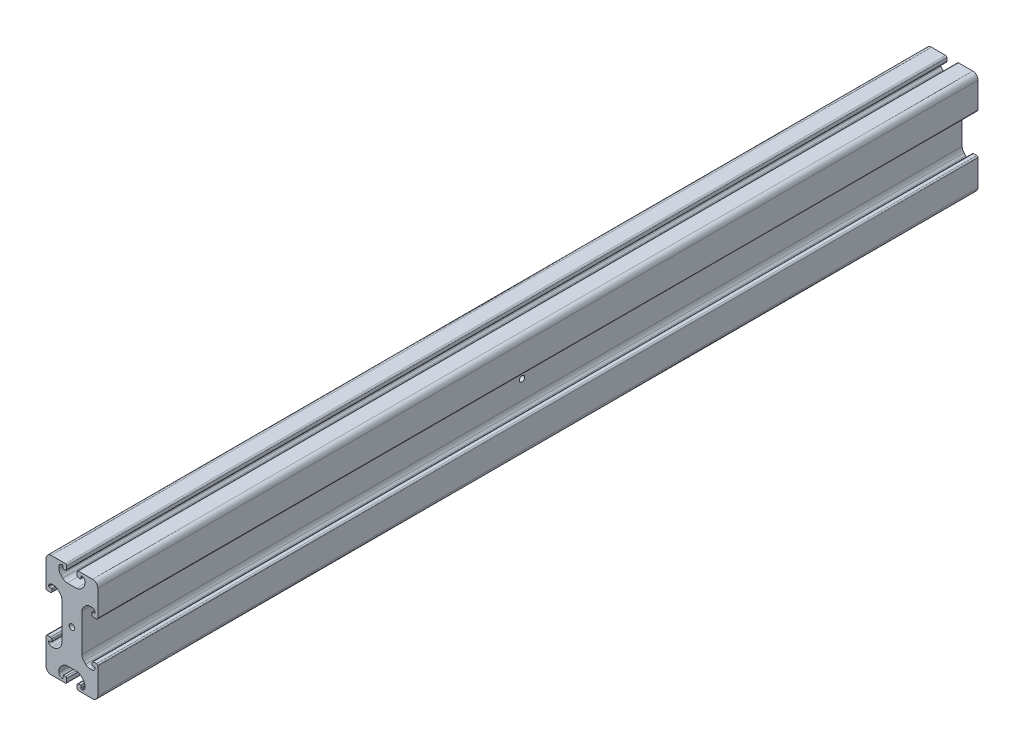
from build123d import *

# Parameters (mm, degrees)
EXTRUDE_3_DEPTH    = 680
HOLE_WIZARD_M5_3_D = 4.2
HOLE_WIZARD_M5_4_D = 4.2


with BuildPart() as part:
    # Model → 凸台-拉伸3 (new body)
    with BuildSketch(Plane.XY):
        with BuildLine():
            Line((3.999472658, -39.000181636), (3.999472658, -36.500124402))
            add(Edge.make_bspline(
                [(3.999472658, -36.500124402), (3.999472658, -36.196236873), (4.293414368, -35.706130333), (4.745630292, -35.500196885), (4.999400134, -35.500196885)],
                knots=[0, 0, 0, 0, 0.565195279, 1, 1, 1, 1], degree=3))
            Line((4.999400134, -35.500196885), (6.499529844, -35.500196885))
            add(Edge.make_bspline(
                [(6.499529844, -35.500196885), (6.63037713, -35.500196885), (6.879742835, -35.617724815), (6.999493611, -35.841806727), (6.999493611, -36.000160635)],
                knots=[0, 0, 0, 0, 0.482405948, 1, 1, 1, 1], degree=3))
            Line((6.999493611, -36.000160635), (6.999493611, -37.550119818))
            add(Edge.make_bspline(
                [(6.999493611, -37.550119818), (6.999493611, -37.68387873), (7.126407697, -37.905146806), (7.329892845, -38.000254077), (7.449389479, -38.000254077)],
                knots=[0, 0, 0, 0, 0.549542039, 1, 1, 1, 1], degree=3))
            Line((7.449389479, -38.000254077), (7.499457385, -38.000254077))
            add(Edge.make_bspline(
                [(7.499457385, -38.000254077), (8.196685376, -38.000254077), (9.439597977, -37.396472021), (9.999514571, -36.259346854), (9.999514571, -35.500196937)],
                knots=[0, 0, 0, 0, 0.502793736, 1, 1, 1, 1], degree=3))
            Line((9.999514571, -35.500196937), (9.999514571, -34.192709266))
            add(Edge.make_bspline(
                [(9.999514571, -34.192709266), (9.999514571, -33.503441971), (9.70814132, -32.22115212), (9.008369725, -31.13073904), (8.534909328, -30.657200372)],
                knots=[0, 0, 0, 0, 0.510203542, 1, 1, 1, 1], degree=3))
            Line((8.534909328, -30.657200372), (7.092715241, -29.214767864))
            add(Edge.make_bspline(
                [(7.092715241, -29.214767864), (6.626557723, -28.748533282), (5.520442081, -28.038933473), (4.256932424, -27.750162542), (3.556967756, -27.750162542)],
                knots=[0, 0, 0, 0, 0.489373028, 1, 1, 1, 1], degree=3))
            Line((3.556967756, -27.750162542), (-3.558157913, -27.750162542))
            add(Edge.make_bspline(
                [(-7.093905398, -29.214767864), (-6.62774788, -28.748533282), (-5.521632239, -28.038933473), (-4.258122582, -27.750162542), (-3.558157913, -27.750162542)],
                knots=[0, 0, 0, 0, 0.489373028, 1, 1, 1, 1], degree=3))
            Line((-7.093905398, -29.214767864), (-8.536099486, -30.657200372))
            add(Edge.make_bspline(
                [(-10.000704728, -34.192709266), (-10.000704728, -33.503441971), (-9.709331478, -32.22115212), (-9.009559883, -31.13073904), (-8.536099486, -30.657200372)],
                knots=[0, 0, 0, 0, 0.510203542, 1, 1, 1, 1], degree=3))
            Line((-10.000704728, -34.192709266), (-10.000704728, -35.500196937))
            add(Edge.make_bspline(
                [(-7.500647542, -38.000254077), (-8.197875534, -38.000254077), (-9.440788134, -37.396472021), (-10.000704728, -36.259346854), (-10.000704728, -35.500196937)],
                knots=[0, 0, 0, 0, 0.502793736, 1, 1, 1, 1], degree=3))
            Line((-7.500647542, -38.000254077), (-7.450579636, -38.000254077))
            add(Edge.make_bspline(
                [(-7.000683769, -37.550119818), (-7.000683769, -37.68387873), (-7.127597855, -37.905146806), (-7.331083002, -38.000254077), (-7.450579636, -38.000254077)],
                knots=[0, 0, 0, 0, 0.549542039, 1, 1, 1, 1], degree=3))
            Line((-7.000683769, -37.550119818), (-7.000683769, -36.000160635))
            add(Edge.make_bspline(
                [(-6.500720002, -35.500196885), (-6.631567288, -35.500196885), (-6.880932992, -35.617724815), (-7.000683769, -35.841806727), (-7.000683769, -36.000160635)],
                knots=[0, 0, 0, 0, 0.482405948, 1, 1, 1, 1], degree=3))
            Line((-6.500720002, -35.500196885), (-5.000590292, -35.500196885))
            add(Edge.make_bspline(
                [(-4.000662815, -36.500124402), (-4.000662815, -36.196236873), (-4.294604526, -35.706130333), (-4.74682045, -35.500196885), (-5.000590292, -35.500196885)],
                knots=[0, 0, 0, 0, 0.565195279, 1, 1, 1, 1], degree=3))
            Line((-4.000662815, -36.500124402), (-4.000662815, -39.000181636))
            add(Edge.make_bspline(
                [(-5.000590371, -40.000229591), (-4.784189842, -40.000231912), (-4.285443251, -39.782455558), (-4.000662815, -39.355924286), (-4.000662815, -39.000181636)],
                knots=[0, 0, 0, 0, 0.421033767, 1, 1, 1, 1], degree=3))
            Line((-5.000590371, -40.000229591), (-16.000746773, -40.000347536))
            add(Edge.make_bspline(
                [(-16.000746773, -40.000347536), (-17.349688489, -40.000333073), (-19.09346858, -38.939702082), (-20.000695162, -36.942666397), (-20.000695162, -36.000042867)],
                knots=[0, 0, 0, 0, 0.5505478, 1, 1, 1, 1], degree=3))
            Line((-20.000695162, -36.000042867), (-20.000598045, -15.942432522))
            add(Edge.make_bspline(
                [(-20.000598045, -15.942432522), (-20.000598045, -15.605249138), (-19.735530395, -15.169209703), (-19.236197926, -14.942504908), (-19.000432174, -14.942504908)],
                knots=[0, 0, 0, 0, 0.550414522, 1, 1, 1, 1], degree=3))
            Line((-19.000432174, -14.942504908), (-16.500613361, -14.942504908))
            add(Edge.make_bspline(
                [(-16.500613361, -14.942504908), (-16.164706379, -14.942504908), (-15.72801004, -15.206023191), (-15.500447428, -15.705242106), (-15.500447428, -15.942432383)],
                knots=[0, 0, 0, 0, 0.548463708, 1, 1, 1, 1], degree=3))
            Line((-15.500447428, -15.942432383), (-15.500447428, -17.4425621))
            add(Edge.make_bspline(
                [(-15.500447428, -17.4425621), (-15.500447428, -17.608710279), (-15.630522706, -17.827868173), (-15.880200984, -17.942525865), (-16.000649583, -17.942525865)],
                knots=[0, 0, 0, 0, 0.543007867, 1, 1, 1, 1], degree=3))
            Line((-16.000649583, -17.942525865), (-17.550608771, -17.942525865))
            add(Edge.make_bspline(
                [(-17.550608771, -17.942525865), (-17.717479695, -17.942525865), (-17.906336203, -18.07710785), (-18.000504622, -18.301237903), (-18.000504622, -18.39242171)],
                knots=[0, 0, 0, 0, 0.601271686, 1, 1, 1, 1], degree=3))
            Line((-18.000504622, -18.39242171), (-18.000504622, -18.442489684))
            add(Edge.make_bspline(
                [(-18.000504622, -18.442489684), (-18.000504622, -19.274352714), (-17.350615539, -20.370387522), (-16.102445977, -20.942546832), (-15.500447386, -20.942546832)],
                knots=[0, 0, 0, 0, 0.54350612, 1, 1, 1, 1], degree=3))
            Line((-15.500447386, -20.942546832), (-14.192959898, -20.942546832))
            add(Edge.make_bspline(
                [(-14.192959898, -20.942546832), (-13.514309542, -20.942546832), (-12.246415164, -20.669775925), (-11.141172405, -19.961663094), (-10.657450902, -19.477941591)],
                knots=[0, 0, 0, 0, 0.495306505, 1, 1, 1, 1], degree=3))
            Line((-10.657450902, -19.477941591), (-9.21501842, -18.03550911))
            add(Edge.make_bspline(
                [(-9.21501842, -18.03550911), (-8.750710178, -17.571200868), (-8.056726555, -16.479176153), (-7.750651503, -15.196538932), (-7.750651503, -14.499999999)],
                knots=[0, 0, 0, 0, 0.481772339, 1, 1, 1, 1], degree=3))
            Line((-7.750651503, -14.499999999), (-7.750340561, 14.499999999))
            add(Edge.make_bspline(
                [(-9.214631662, 18.035540511), (-8.750333377, 17.571222312), (-8.056373171, 16.479182716), (-7.750325625, 15.196538932), (-7.750340561, 14.499999999)],
                knots=[0, 0, 0, 0, 0.481772339, 1, 1, 1, 1], degree=3))
            Line((-9.214631662, 18.035540511), (-10.657033212, 19.478003924))
            add(Edge.make_bspline(
                [(-14.1925108, 20.942684981), (-13.513860444, 20.942670428), (-12.245971916, 20.669872332), (-11.140744342, 19.9617358), (-10.657033212, 19.478003924)],
                knots=[0, 0, 0, 0, 0.495306505, 1, 1, 1, 1], degree=3))
            Line((-14.1925108, 20.942684981), (-15.499998287, 20.942713019))
            add(Edge.make_bspline(
                [(-18.000109135, 18.442709483), (-18.000091296, 19.274572513), (-17.350178709, 20.370593385), (-16.101996879, 20.942725928), (-15.499998287, 20.942713019)],
                knots=[0, 0, 0, 0, 0.54350612, 1, 1, 1, 1], degree=3))
            Line((-18.000109135, 18.442709483), (-18.000110208, 18.392641509))
            add(Edge.make_bspline(
                [(-17.550224005, 17.942736017), (-17.717094929, 17.942739596), (-17.905948552, 18.07732563), (-18.000112164, 18.301457703), (-18.000110208, 18.392641509)],
                knots=[0, 0, 0, 0, 0.601271686, 1, 1, 1, 1], degree=3))
            Line((-17.550224005, 17.942736017), (-16.000264818, 17.942702779))
            add(Edge.make_bspline(
                [(-15.500073384, 17.442728288), (-15.500069821, 17.608876467), (-15.630140399, 17.82803715), (-15.879816219, 17.942700197), (-16.000264818, 17.942702779)],
                knots=[0, 0, 0, 0, 0.543007867, 1, 1, 1, 1], degree=3))
            Line((-15.500073384, 17.442728288), (-15.500105553, 15.942598571))
            add(Edge.make_bspline(
                [(-16.500292929, 14.942692544), (-16.164385947, 14.942685341), (-15.727683957, 15.206194259), (-15.500110639, 15.705408295), (-15.500105553, 15.942598571)],
                knots=[0, 0, 0, 0, 0.548463708, 1, 1, 1, 1], degree=3))
            Line((-16.500292929, 14.942692544), (-19.000111741, 14.942746151))
            add(Edge.make_bspline(
                [(-20.000256169, 15.942695212), (-20.000263399, 15.605511828), (-19.735205101, 15.169466709), (-19.235877493, 14.942751207), (-19.000111741, 14.942746151)],
                knots=[0, 0, 0, 0, 0.550414522, 1, 1, 1, 1], degree=3))
            Line((-20.000256169, 15.942695212), (-19.999923167, 36.000305555))
            add(Edge.make_bspline(
                [(-15.999888995, 40.000524447), (-17.348830711, 40.000538911), (-19.092633546, 38.939945314), (-19.999902953, 36.942929084), (-19.999923167, 36.000305555)],
                knots=[0, 0, 0, 0, 0.5505478, 1, 1, 1, 1], degree=3))
            Line((-15.999888995, 40.000524447), (-4.999732598, 40.000170613))
            add(Edge.make_bspline(
                [(-4.999732598, 40.000170613), (-4.783332069, 40.000168292), (-4.284590148, 39.782381243), (-3.999818859, 39.355843864), (-3.999826488, 39.000101215)],
                knots=[0, 0, 0, 0, 0.421033767, 1, 1, 1, 1], degree=3))
            Line((-3.999826488, 39.000101215), (-3.999880099, 36.500043982))
            add(Edge.make_bspline(
                [(-3.999880099, 36.500043982), (-3.999886616, 36.196156452), (-4.293838837, 35.706056216), (-4.746059177, 35.500132465), (-4.999829019, 35.500137907)],
                knots=[0, 0, 0, 0, 0.565195279, 1, 1, 1, 1], degree=3))
            Line((-4.999829019, 35.500137907), (-6.499958728, 35.500170076))
            add(Edge.make_bspline(
                [(-6.499958728, 35.500170076), (-6.630806014, 35.500172882), (-6.880169198, 35.617706159), (-6.999915169, 35.841790639), (-6.999911774, 36.000144548)],
                knots=[0, 0, 0, 0, 0.482405948, 1, 1, 1, 1], degree=3))
            Line((-6.999911774, 36.000144548), (-6.999878536, 37.55010373))
            add(Edge.make_bspline(
                [(-6.999878536, 37.55010373), (-6.999875668, 37.683862643), (-7.126785009, 37.90513344), (-7.330268117, 38.000245074), (-7.449764751, 38.000247636)],
                knots=[0, 0, 0, 0, 0.549542039, 1, 1, 1, 1], degree=3))
            Line((-7.449764751, 38.000247636), (-7.499832657, 38.00024871))
            add(Edge.make_bspline(
                [(-7.499832657, 38.00024871), (-8.197060648, 38.000263662), (-9.439986196, 37.39650826), (-9.999927175, 36.2593951), (-9.999943454, 35.500245183)],
                knots=[0, 0, 0, 0, 0.502793736, 1, 1, 1, 1], degree=3))
            Line((-9.999943454, 35.500245183), (-9.999971492, 34.192757512))
            add(Edge.make_bspline(
                [(-9.999971492, 34.192757512), (-9.999986273, 33.503490217), (-9.70864052, 32.221194118), (-9.008892308, 31.130766033), (-8.535442066, 30.657217212)],
                knots=[0, 0, 0, 0, 0.510203542, 1, 1, 1, 1], degree=3))
            Line((-8.535442066, 30.657217212), (-7.093278911, 29.214753777))
            add(Edge.make_bspline(
                [(-7.093278911, 29.214753777), (-6.627131391, 28.748509199), (-5.521030966, 28.038885671), (-4.257527502, 27.750087644), (-3.557562834, 27.750072634)],
                knots=[0, 0, 0, 0, 0.489373028, 1, 1, 1, 1], degree=3))
            Line((-3.557562834, 27.750072634), (3.557562834, 27.749920055))
            add(Edge.make_bspline(
                [(7.093341725, 29.214449556), (6.627174209, 28.748224971), (5.521043351, 28.038648882), (4.257527502, 27.749905045), (3.557562834, 27.749920055)],
                knots=[0, 0, 0, 0, 0.489373028, 1, 1, 1, 1], degree=3))
            Line((7.093341725, 29.214449556), (8.535566744, 30.656851137))
            add(Edge.make_bspline(
                [(10.000247803, 34.192328623), (10.000233022, 33.503061328), (9.708832274, 32.220777725), (9.009037296, 31.130379652), (8.535566744, 30.656851137)],
                knots=[0, 0, 0, 0, 0.510203542, 1, 1, 1, 1], degree=3))
            Line((10.000247803, 34.192328623), (10.000275841, 35.499816294))
            add(Edge.make_bspline(
                [(7.500272267, 37.999927045), (8.197500259, 37.999912093), (9.440399911, 37.396103385), (10.00029212, 36.25896621), (10.000275841, 35.499816294)],
                knots=[0, 0, 0, 0, 0.502793736, 1, 1, 1, 1], degree=3))
            Line((7.500272267, 37.999927045), (7.450204361, 37.999928118))
            add(Edge.make_bspline(
                [(7.000298841, 37.549803507), (7.000301709, 37.68356242), (7.12722054, 37.904827774), (7.330707727, 37.999930681), (7.450204361, 37.999928118)],
                knots=[0, 0, 0, 0, 0.549542039, 1, 1, 1, 1], degree=3))
            Line((7.000298841, 37.549803507), (7.000265603, 35.999844325))
            add(Edge.make_bspline(
                [(6.500291115, 35.499891296), (6.631138401, 35.49988849), (6.880506626, 35.617411073), (7.000262207, 35.841490416), (7.000265603, 35.999844325)],
                knots=[0, 0, 0, 0, 0.482405948, 1, 1, 1, 1], degree=3))
            Line((6.500291115, 35.499891296), (5.000161405, 35.499923465))
            add(Edge.make_bspline(
                [(4.000255372, 36.499872425), (4.000248855, 36.195984896), (4.294180056, 35.705872052), (4.746391563, 35.499928907), (5.000161405, 35.499923465)],
                knots=[0, 0, 0, 0, 0.565195279, 1, 1, 1, 1], degree=3))
            Line((4.000255372, 36.499872425), (4.000308983, 38.999929658))
            add(Edge.make_bspline(
                [(5.000257984, 39.999956171), (4.783857456, 39.999963131), (4.285106194, 39.782197473), (4.000316612, 39.355672308), (4.000308983, 38.999929658)],
                knots=[0, 0, 0, 0, 0.421033767, 1, 1, 1, 1], degree=3))
            Line((5.000257984, 39.999956171), (16.000414386, 39.999838226))
            add(Edge.make_bspline(
                [(16.000414386, 39.999838226), (17.349356102, 39.999794835), (19.093113448, 38.939126451), (20.000297205, 36.942071311), (20.000276991, 35.999447782)],
                knots=[0, 0, 0, 0, 0.5505478, 1, 1, 1, 1], degree=3))
            Line((20.000276991, 35.999447782), (20.000041106, 15.942169831))
            add(Edge.make_bspline(
                [(20.000041106, 15.942169831), (20.000033876, 15.604986447), (19.734956876, 15.168952696), (19.235619546, 14.942258609), (18.999853793, 14.942263665)],
                knots=[0, 0, 0, 0, 0.550414522, 1, 1, 1, 1], degree=3))
            Line((18.999853793, 14.942263665), (16.500034981, 14.942317272))
            add(Edge.make_bspline(
                [(16.500034981, 14.942317272), (16.164127999, 14.942324475), (15.727437311, 15.205852123), (15.499885404, 15.705075918), (15.49989049, 15.942266194)],
                knots=[0, 0, 0, 0, 0.548463708, 1, 1, 1, 1], degree=3))
            Line((15.49989049, 15.942266194), (15.499922659, 17.442395911))
            add(Edge.make_bspline(
                [(15.499922659, 17.442395911), (15.499926222, 17.60854409), (15.6300062, 17.827699194), (15.879686937, 17.942351533), (16.000135536, 17.94234895)],
                knots=[0, 0, 0, 0, 0.543007867, 1, 1, 1, 1], degree=3))
            Line((16.000135536, 17.94234895), (17.550094723, 17.942315712))
            add(Edge.make_bspline(
                [(17.550094723, 17.942315712), (17.716965647, 17.942312134), (17.905825042, 18.076890069), (17.999998267, 18.301018102), (18.000000222, 18.392201909)],
                knots=[0, 0, 0, 0, 0.601271686, 1, 1, 1, 1], degree=3))
            Line((18.000000222, 18.392201909), (18.000001296, 18.442269883))
            add(Edge.make_bspline(
                [(18.000001296, 18.442269883), (18.000019135, 19.274132913), (17.350153555, 20.370181657), (16.101996264, 20.942367733), (15.499997672, 20.942380642)],
                knots=[0, 0, 0, 0, 0.54350612, 1, 1, 1, 1], degree=3))
            Line((15.499997672, 20.942380642), (14.192510185, 20.94240868))
            add(Edge.make_bspline(
                [(14.192510185, 20.94240868), (13.513859829, 20.942423233), (12.245959602, 20.669679516), (11.140701658, 19.961590386), (10.656969782, 19.477879256)],
                knots=[0, 0, 0, 0, 0.495306505, 1, 1, 1, 1], degree=3))
            Line((10.656969782, 19.477879256), (9.214506369, 18.035477707))
            add(Edge.make_bspline(
                [(9.214506369, 18.035477707), (8.75018817, 17.571179421), (8.056181129, 16.479169589), (7.750078572, 15.196538932), (7.750063635, 14.499999999)],
                knots=[0, 0, 0, 0, 0.481772339, 1, 1, 1, 1], degree=3))
            Line((7.750063635, 14.499999999), (7.750063635, -14.499999999))
            add(Edge.make_bspline(
                [(9.214430553, -18.03550911), (8.750122311, -17.571200868), (8.056138687, -16.479176153), (7.750063635, -15.196538932), (7.750063635, -14.499999999)],
                knots=[0, 0, 0, 0, 0.481772339, 1, 1, 1, 1], degree=3))
            Line((9.214430553, -18.03550911), (10.656863035, -19.477941591))
            add(Edge.make_bspline(
                [(14.192372031, -20.942546832), (13.513721675, -20.942546832), (12.245827297, -20.669775925), (11.140584537, -19.961663094), (10.656863035, -19.477941591)],
                knots=[0, 0, 0, 0, 0.495306505, 1, 1, 1, 1], degree=3))
            Line((14.192372031, -20.942546832), (15.499859519, -20.942546832))
            add(Edge.make_bspline(
                [(17.999916755, -18.442489684), (17.999916755, -19.274352714), (17.350027671, -20.370387522), (16.10185811, -20.942546832), (15.499859519, -20.942546832)],
                knots=[0, 0, 0, 0, 0.54350612, 1, 1, 1, 1], degree=3))
            Line((17.999916755, -18.442489684), (17.999916755, -18.39242171))
            add(Edge.make_bspline(
                [(17.550020903, -17.942525865), (17.716891827, -17.942525865), (17.905748336, -18.07710785), (17.999916755, -18.301237903), (17.999916755, -18.39242171)],
                knots=[0, 0, 0, 0, 0.601271686, 1, 1, 1, 1], degree=3))
            Line((17.550020903, -17.942525865), (16.000061716, -17.942525865))
            add(Edge.make_bspline(
                [(15.49985956, -17.4425621), (15.49985956, -17.608710279), (15.629934839, -17.827868173), (15.879613117, -17.942525865), (16.000061716, -17.942525865)],
                knots=[0, 0, 0, 0, 0.543007867, 1, 1, 1, 1], degree=3))
            Line((15.49985956, -17.4425621), (15.49985956, -15.942432383))
            add(Edge.make_bspline(
                [(16.500025494, -14.942504908), (16.164118512, -14.942504908), (15.727422172, -15.206023191), (15.49985956, -15.705242106), (15.49985956, -15.942432383)],
                knots=[0, 0, 0, 0, 0.548463708, 1, 1, 1, 1], degree=3))
            Line((16.500025494, -14.942504908), (18.999844307, -14.942504908))
            add(Edge.make_bspline(
                [(20.000010177, -15.942432522), (20.000010177, -15.605249138), (19.734942528, -15.169209703), (19.235610059, -14.942504908), (18.999844307, -14.942504908)],
                knots=[0, 0, 0, 0, 0.550414522, 1, 1, 1, 1], degree=3))
            Line((20.000010177, -15.942432522), (19.999505005, -36.000042867))
            add(Edge.make_bspline(
                [(15.999556616, -40.000347536), (17.348498332, -40.000333073), (19.092278422, -38.939702082), (19.999505005, -36.942666397), (19.999505005, -36.000042867)],
                knots=[0, 0, 0, 0, 0.5505478, 1, 1, 1, 1], degree=3))
            Line((15.999556616, -40.000347536), (4.999400213, -40.000229591))
            add(Edge.make_bspline(
                [(4.999400213, -40.000229591), (4.782999685, -40.000231912), (4.284253093, -39.782455558), (3.999472658, -39.355924286), (3.999472658, -39.000181636)],
                knots=[0, 0, 0, 0, 0.421033767, 1, 1, 1, 1], degree=3))
        make_face()
    extrude(amount=EXTRUDE_3_DEPTH)

    # M5 螺纹孔3 (through all)
    with Locations(Plane(origin=(0, 0, 0), x_dir=(-1, 0, 0), z_dir=(0, 0, -1))):
        with Locations((0, 0)):
            Hole(HOLE_WIZARD_M5_3_D / 2)

    # M5 螺纹孔4 (through all)
    with Locations(Plane(origin=(-7.750496031, 8.3102e-05, 0), x_dir=(0, 0, 1), z_dir=(-0.9999999999425182, 1.07221093766048e-05, 0))):
        with Locations((340, 0)):
            Hole(HOLE_WIZARD_M5_4_D / 2)


solid = part.part
